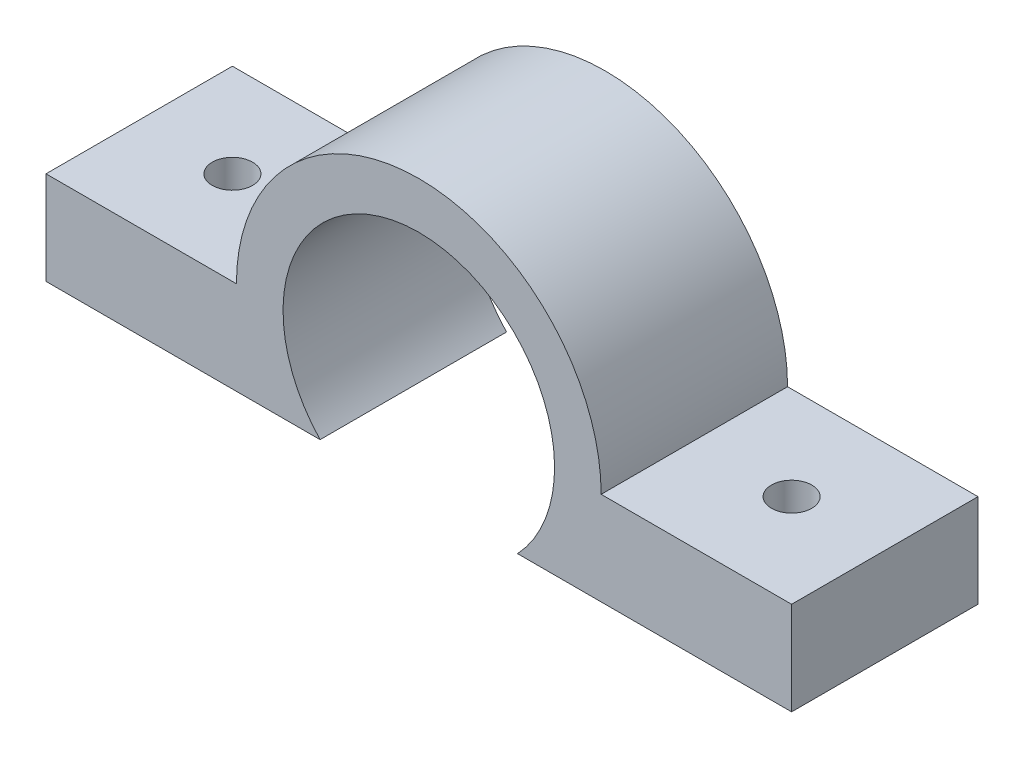
from build123d import *

# Parameters (mm, degrees)
BOSS_EXTRUDE2_DEPTH  = 25.4
M5_CLEARANCE_HOLE2_D = 5.5


with BuildPart() as part:
    # Sketch1<3> → Boss-Extrude2 (new body)
    with BuildSketch(Plane.XY):
        with BuildLine():
            Line((13.452137377, 6.35), (50.8, 6.35))
            Line((50.8, 6.35), (50.8, 19.05))
            Line((50.8, 19.05), (24.85, 19.05))
            ThreePointArc((24.85, 19.05), (0, 43.9), (-24.85, 19.05))
            Line((-24.85, 19.05), (-50.8, 19.05))
            Line((-50.8, 19.05), (-50.8, 6.35))
            Line((-50.8, 6.35), (-13.452137377, 6.35))
            ThreePointArc((-13.452137377, 6.35), (0, 37.55), (13.452137377, 6.35))
        make_face()
    extrude(amount=BOSS_EXTRUDE2_DEPTH)

    # M5 Clearance Hole2 (through all)
    with Locations(Plane(origin=(0, 19.05, 0), x_dir=(1, 0, 0), z_dir=(0, 1, 0))):
        with Locations((38.1, -12.7), (-38.1, -12.7)):
            Hole(M5_CLEARANCE_HOLE2_D / 2)


solid = part.part
